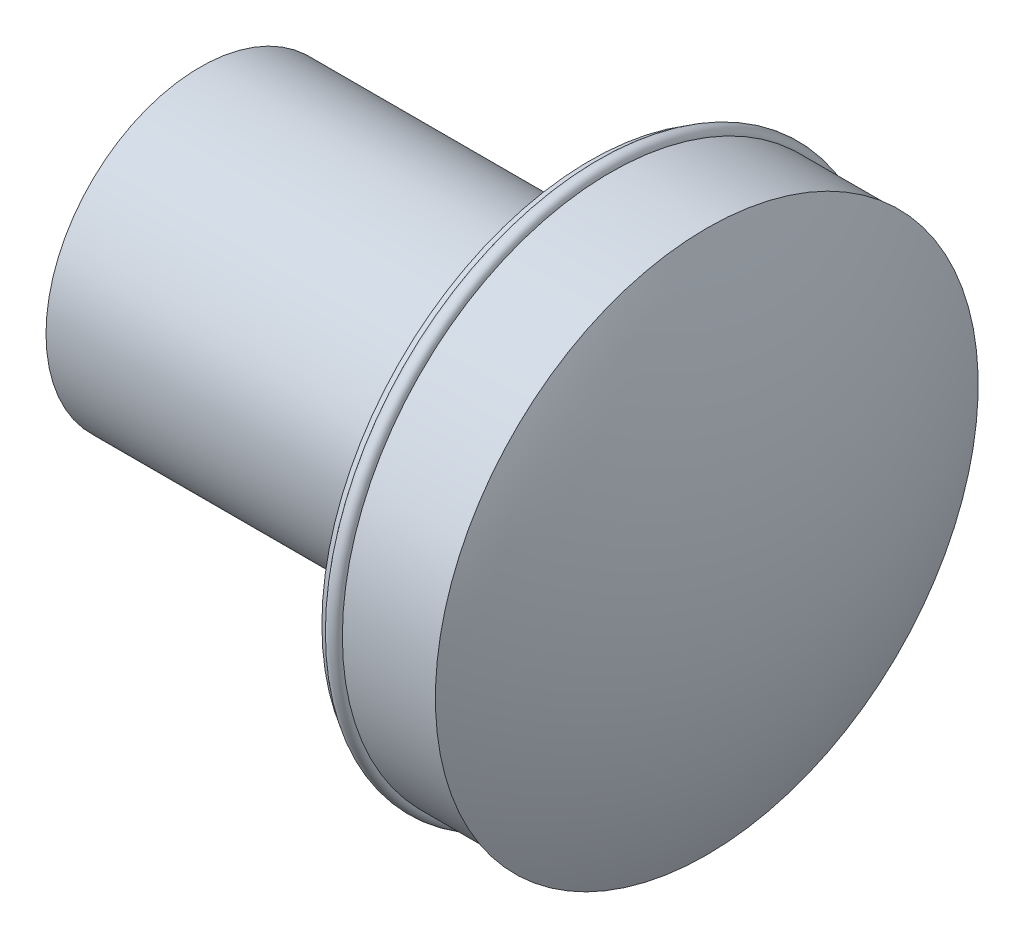
from build123d import *


with BuildPart() as part:
    # Sketch1 → Revolve4 (revolve)
    with BuildSketch(Plane.XY, mode=Mode.PRIVATE) as revolve4_sk:
        with BuildLine():
            Line((52.832, 0), (52.832, 27.94))
            Line((52.832, 27.94), (42.774202723, 27.94))
            ThreePointArc((42.774202723, 27.94), (42.04078305, 28.673419673), (41.307363376, 27.94))
            Line((41.307363376, 27.94), (40.64, 27.94))
            Line((40.64, 27.94), (33.02, 16.064574588))
            Line((33.02, 16.064574588), (0, 16.064574588))
            Line((0, 16.064574588), (0, 0))
            Line((0, 0), (52.832, 0))
        make_face()
    revolve(revolve4_sk.sketch.rotate(Axis((-76.840094259, 0, 0), (1, 0, 0)), 90), axis=Axis((-76.840094259, 0, 0), (1, 0, 0)))

    # Sketch11 → Revolve7 (revolve)
    with BuildSketch(Plane.XY):
        with BuildLine():
            Line((52.832, 27.94), (52.832, -0.357740308))
            Line((52.832, -0.357740308), (59.182, -0.357740308))
            ThreePointArc((59.182, -0.357740308), (57.575003167, 14.14298904), (52.832, 27.94))
        make_face()
    revolve(axis=Axis((52.832, -0.357740308, 0), (1, 0, 0)))


solid = part.part
